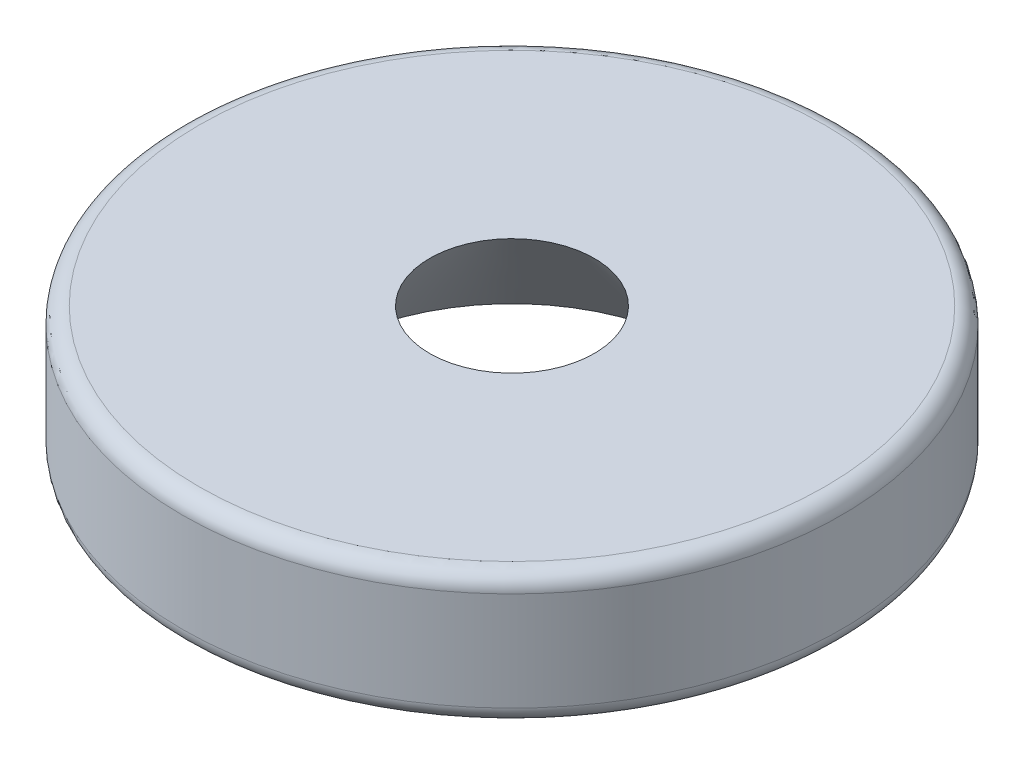
from build123d import *

# Parameters (mm, degrees)
SKETCH_1_R          = 10
EXTRUDE_1_DEPTH     = 4
SKETCH_2_R          = 2.5
CUT_EXTRUDE_1_DEPTH = 4
CUT_EXTRUDE_1_DRAFT = 39
FILLET_2_R          = 0.5
FILLET_3_R          = 0.5


with BuildPart() as part:
    # 草图1 → 凸台-拉伸1 (new body)
    with BuildSketch(Plane(origin=(0, 0, 0), x_dir=(1, 0, 0), z_dir=(0, 1, 0))):
        with Locations(Location((0, 0, 0), (0, 0, 270))):
            Circle(SKETCH_1_R)
    extrude(amount=EXTRUDE_1_DEPTH)


with BuildPart() as cut_extrude_1_tool:
    # 草图2 → 切除-拉伸1 (with draft: the straight prism first)
    with BuildSketch(Plane(origin=(0, 4, 0), x_dir=(1, 0, 0), z_dir=(0, 1, 0))):
        Circle(SKETCH_2_R)
    extrude(amount=-CUT_EXTRUDE_1_DEPTH)
    # 切除-拉伸1: the draft: its side faces are tilted about the plane it starts from
    cut_extrude_1_sides = [cut_extrude_1_tool.faces().sort_by_distance(p)[0] for p in [
        (-2.5, 2, 0),
    ]]
    draft(cut_extrude_1_sides, Plane(origin=(0, 4, 0), x_dir=(1, 0, 0), z_dir=(0, 1, 0)), CUT_EXTRUDE_1_DRAFT)


with BuildPart() as part_1:
    add(part.part)

    # 切除-拉伸1: cut by cut_extrude_1_tool
    add(cut_extrude_1_tool.part, mode=Mode.SUBTRACT)

    # 圆角2
    fillet_2_edges = [part_1.edges().sort_by_distance(p)[0] for p in [
        (0, 0, -10),
    ]]
    fillet(fillet_2_edges, radius=FILLET_2_R)

    # 圆角3
    fillet_3_edges = [part_1.edges().sort_by_distance(p)[0] for p in [
        (0, 4, -10),
    ]]
    fillet(fillet_3_edges, radius=FILLET_3_R)


solid = part_1.part
